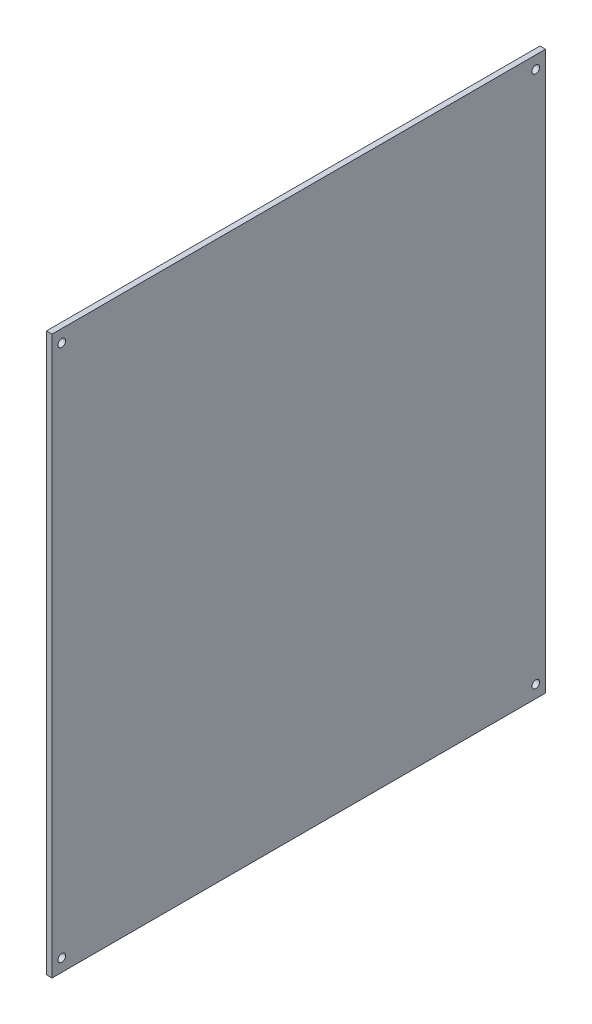
from build123d import *

# Parameters (mm, degrees)
SKETCH_1_W          = 354
SKETCH_1_H          = 400
EXTRUDE_1_DEPTH     = 4
SKETCH_2_R          = 2.75
CUT_EXTRUDE_1_DEPTH = 4


with BuildPart() as part:
    # 草图1 → 凸台-拉伸1 (new body)
    with BuildSketch(Plane(origin=(0, 0, 0), x_dir=(0, 0, -1), z_dir=(1, 0, 0))):
        with Locations((177, 200)):
            Rectangle(SKETCH_1_W, SKETCH_1_H)
    extrude(amount=EXTRUDE_1_DEPTH)

    # 草图2 → 切除-拉伸1 (cut)
    with BuildSketch(Plane(origin=(4, 0, 0), x_dir=(0, 0, -1), z_dir=(1, 0, 0))):
        with Locations((7, 391)):
            Circle(SKETCH_2_R)
        with Locations((7, 9)):
            Circle(SKETCH_2_R)
        with Locations(Location((347, 9, 0), (0, 0, 180))):
            Circle(SKETCH_2_R)
        with Locations(Location((347, 391, 0), (0, 0, 180))):
            Circle(SKETCH_2_R)
    extrude(amount=-CUT_EXTRUDE_1_DEPTH, mode=Mode.SUBTRACT)


solid = part.part
